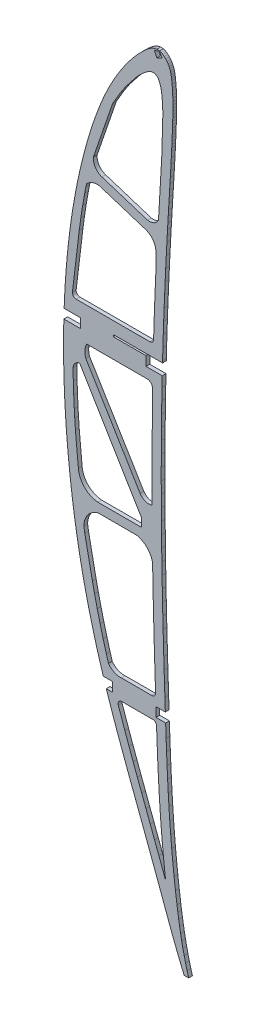
from build123d import *

# Parameters (mm, degrees)
EXTRUDE_1_DEPTH = 2


with BuildPart() as part:
    # Model → 凸台-拉伸1 (new body)
    with BuildSketch(Plane.XY):
        Polygon((90.473003067, 1.41610891), (89.253557397, 4.288175533), (87.979767081, 7.350528261), (86.732471254, 10.425048243), (85.532789181, 13.463610884), (84.359776075, 16.510344587), (83.207437646, 19.564987634), (82.069866843, 22.625280213), (80.942112045, 25.690005178), (78.696331215, 31.825885593), (76.43986619, 37.954292857), (74.167721729, 44.075008873), (71.882851357, 50.189163547), (69.589164029, 56.298929455), (67.29052508, 62.407478217), (64.987846318, 68.51685155), (62.687034794, 74.629309266), (60.403516624, 80.712493446), (58.137806844, 86.800458967), (55.899721459, 92.897638218), (53.702073618, 99.008594441), (51.556721043, 105.136848216), (48.778942839, 113.429300475), (52.16898735, 113.429300475), (52.16898735, 118.429300475), (47.16898735, 118.429300475), (45.586350646, 123.53893903), (43.790673343, 129.636416133), (42.081040848, 135.757669087), (40.460450305, 141.902828751), (38.927946285, 148.070852457), (37.487524982, 154.261914681), (36.138230966, 160.474972757), (34.901671713, 166.604869103), (33.753547937, 172.749637105), (32.690818877, 178.910144953), (31.711617292, 185.083308263), (30.812946039, 191.268996178), (29.991807972, 197.467077839), (29.246248616, 203.676466959), (28.577057316, 209.856158942), (27.981708345, 216.041076856), (27.459246275, 222.230178034), (27.010582916, 228.425504191), (26.636760934, 234.626099898), (26.339778426, 240.832052395), (26.118679964, 247.042319013), (25.975158308, 253.263980329), (25.909736891, 259.485047765), (25.926411906, 265.705695797), (26.024227924, 271.924881759), (26.068234366, 273.429300475), (34.851363013, 273.429300475), (34.851363013, 278.429300475), (33.851363013, 278.429300475), (26.218453414, 278.429300475), (26.474228879, 284.360346332), (26.82945458, 290.575756753), (27.279795366, 296.85938096), (27.825569166, 303.13516043), (28.469947602, 309.399229829), (29.218968583, 315.650851824), (30.075760111, 321.887160129), (31.046360095, 328.107417412), (32.134851967, 334.309800055), (32.736576301, 337.470054764), (33.370662752, 340.622713859), (34.03811037, 343.767820961), (34.736877437, 346.906287877), (35.470048338, 350.036247371), (36.236536785, 353.159653918), (37.038384494, 356.27559571), (37.89707812, 359.465087089), (38.794302631, 362.643248378), (39.73309879, 365.809211386), (40.715508313, 368.962064305), (41.744615584, 372.099939896), (42.822462319, 375.22192635), (43.952045662, 378.328154524), (44.559657154, 379.932184847), (45.181517037, 381.530831551), (45.819710646, 383.12218378), (46.475237031, 384.706285153), (47.148183429, 386.281137573), (47.838506221, 387.847740089), (48.549289791, 389.404225462), (49.315270137, 391.026180797), (50.103796595, 392.636108133), (50.916780024, 394.236092803), (51.753308614, 395.824093092), (52.614206936, 397.404148812), (53.502559373, 398.974392725), (54.418278687, 400.536822928), (55.437097076, 402.213859329), (56.48754025, 403.877262208), (57.565005544, 405.517822033), (58.667669338, 407.131455374), (59.7947943, 408.712124321), (60.942689573, 410.252661059), (62.110574206, 411.748026728), (62.837246184, 412.642575126), (63.57747284, 413.52470295), (64.33603132, 414.399623536), (65.119566005, 415.275634608), (65.934808517, 416.159035789), (66.787491429, 417.056083085), (67.68534541, 417.973119742), (68.936807891, 419.204880131), (70.257645091, 420.406638048), (71.630192071, 421.50154982), (73.03773932, 422.413814442), (74.461622851, 423.066544624), (75.886175821, 423.382983932), (77.292734243, 423.286245075), (78.143620727, 422.993296421), (78.15449601, 422.989552209), (78.990530005, 422.525577899), (79.786583637, 421.922727491), (80.53066413, 421.20349928), (81.210560612, 420.395386804), (81.813194019, 419.522842836), (82.326397097, 418.612361863), (82.699716633, 417.787861091), (83.002321842, 416.955268101), (83.244203207, 416.115019087), (83.436350258, 415.267593862), (83.588709857, 414.414427669), (83.712227916, 413.55699937), (83.815895868, 412.695701538), (83.976199307, 411.156228638), (84.108660253, 409.612537252), (84.216319471, 408.063759187), (84.299089722, 406.511892542), (84.359968151, 404.957068173), (84.399866568, 403.401327798), (84.420695829, 401.84675675), (84.423673081, 400.288403409), (84.410534703, 398.732349302), (84.383322411, 397.17768262), (84.345120589, 395.622536125), (84.298839142, 394.069038772), (84.245564358, 392.515236082), (84.187337951, 390.960216248), (84.128199736, 389.403154698), (84.066020756, 387.846961337), (84.00184368, 386.290680738), (83.935668508, 384.734312901), (83.866496191, 383.177814205), (83.794326729, 381.621184651), (83.72015917, 380.064467858), (83.56196443, 376.947600933), (83.392736539, 373.831253244), (83.216428073, 370.716598315), (83.032083601, 367.60259348), (82.844741984, 364.488457786), (82.654403223, 361.374191234), (82.464108081, 358.258925634), (82.274855607, 355.142704605), (82.08755761, 352.027569863), (81.90221409, 348.913521408), (81.720910382, 345.798648383), (81.54160477, 342.683862596), (81.366338971, 339.568252239), (81.194113936, 336.451773691), (80.863388825, 330.225421557), (80.550602962, 324.000853619), (80.254844538, 317.776028164), (79.977112602, 311.550988809), (79.717494392, 305.323737458), (79.477944385, 299.095360399), (79.258506201, 292.864858582), (79.059655454, 286.644264207), (78.881784721, 280.424585839), (78.856366691, 279.429300475), (52.520828256, 279.429300475), (52.520828256, 278.429300475), (70.05698217, 278.429300475), (70.05698217, 273.429300475), (78.705749157, 273.429300475), (78.585074338, 267.98580455), (78.467277356, 261.765746201), (78.369592196, 255.543563094), (78.29197524, 249.320254279), (78.234077532, 243.103812141), (78.196117169, 236.889241439), (78.177138722, 230.675499506), (78.175144095, 224.462499101), (78.191219574, 218.24828575), (78.223323445, 212.03377126), (78.271542945, 205.816957536), (78.334573691, 199.604794296), (78.412546541, 193.394284394), (78.504506066, 187.184385164), (78.611407695, 180.976139274), (78.732339619, 174.767505006), (78.866346408, 168.557439694), (79.014383492, 162.346986005), (79.175364583, 156.138098416), (79.348247014, 149.931732357), (79.531076308, 143.726801539), (79.723939703, 137.521307868), (79.922753769, 131.31707496), (80.129691078, 125.110193863), (80.357055187, 118.429300475), (75.357055187, 118.429300475), (75.357055187, 113.429300475), (80.528909173, 113.429300475), (80.78156074, 106.488904678), (81.024376546, 100.285591975), (81.29116951, 94.083326138), (81.58888935, 87.88341155), (81.923617593, 81.684111831), (82.304345673, 75.485819556), (82.73537512, 69.281715865), (83.221221361, 63.083008384), (83.765880588, 56.889871592), (84.373348996, 50.702479966), (85.045668299, 44.519921696), (85.787790119, 38.343413929), (86.603797889, 32.171133044), (87.043688275, 29.06536479), (87.509335819, 25.965725881), (88.006778428, 22.871478986), (88.542922201, 19.784927535), (89.122718761, 16.707288676), (89.753074205, 13.640865839), (90.439939204, 10.58691979), (91.202827502, 7.48824726), (92.022138116, 4.404049614), (92.864001663, 1.41610891), align=None)
        with BuildLine():
            Line((75.329172034, 320.753316065), (75.051440098, 314.52827671))
            Line((75.051440098, 314.52827671), (74.791821888, 308.301025359))
            Line((74.791821888, 308.301025359), (74.552271881, 302.0726483))
            Line((74.552271881, 302.0726483), (74.332833697, 295.842146483))
            Line((74.332833697, 295.842146483), (74.13398295, 289.621552108))
            Line((74.13398295, 289.621552108), (74.083303286, 287.849415632))
            ThreePointArc((74.083303286, 287.849415632), (73.477974017, 286.472303626), (72.084120633, 285.906588376))
            Line((72.084120633, 285.906588376), (32.626781308, 285.906588376))
            ThreePointArc((32.626781308, 285.906588376), (31.130812418, 286.579155863), (30.640983564, 288.144511299))
            Line((30.640983564, 288.144511299), (34.293296079, 318.628139725))
            Line((34.293296079, 318.628139725), (35.150087607, 324.86444803))
            Line((35.150087607, 324.86444803), (36.120687591, 331.084705314))
            Line((36.120687591, 331.084705314), (37.209179463, 337.287087956))
            Line((37.209179463, 337.287087956), (37.810903797, 340.447342665))
            Line((37.810903797, 340.447342665), (38.260180998, 342.188405306))
            ThreePointArc((38.260180998, 342.188405306), (41.322072446, 344.253225506), (44.990400044, 344.679880321))
            Line((44.990400044, 344.679880321), (69.935330866, 336.724877648))
            ThreePointArc((69.935330866, 336.724877648), (73.685146901, 333.998693125), (75.315891128, 329.658891792))
            Line((75.315891128, 329.658891792), (75.329172034, 320.753316065))
        make_face(mode=Mode.SUBTRACT)
        with BuildLine():
            Line((31.889300602, 230.437217329), (31.636760934, 234.626099898))
            Line((31.636760934, 234.626099898), (31.339778426, 240.832052395))
            Line((31.339778426, 240.832052395), (31.118679964, 247.042319013))
            Line((31.118679964, 247.042319013), (30.975158308, 253.263980329))
            ThreePointArc((30.975158308, 253.263980329), (32.064829087, 255.843178682), (34.506592179, 257.213375584))
            Line((34.506592179, 257.213375584), (67.600794136, 202.155839455))
            Line((67.600794136, 202.155839455), (67.600794136, 197.619168225))
            Line((67.600794136, 197.619168225), (44.26989943, 197.619168225))
            ThreePointArc((44.26989943, 197.619168225), (37.079099453, 200.952980917), (33.822596969, 208.179121169))
            Line((33.822596969, 208.179121169), (32.264348235, 224.892709601))
            Line((32.264348235, 224.892709601), (31.889300602, 230.437217329))
        make_face(mode=Mode.SUBTRACT)
        with BuildLine():
            Line((57.101110617, 111.634796951), (73.665715927, 111.634796951))
            ThreePointArc((73.665715927, 111.634796951), (75.053967379, 111.074504527), (75.66439206, 109.707554856))
            Line((75.66439206, 109.707554856), (75.78156074, 106.488904678))
            Line((75.78156074, 106.488904678), (76.024376546, 100.285591975))
            Line((76.024376546, 100.285591975), (76.29116951, 94.083326138))
            Line((76.29116951, 94.083326138), (76.58888935, 87.88341155))
            Line((76.58888935, 87.88341155), (76.923617593, 81.684111831))
            Line((76.923617593, 81.684111831), (77.304345673, 75.485819556))
            Line((77.304345673, 75.485819556), (77.73537512, 69.281715865))
            Line((77.73537512, 69.281715865), (78.221221361, 63.083008384))
            Line((78.221221361, 63.083008384), (78.765880588, 56.889871592))
            Line((78.765880588, 56.889871592), (79.373348996, 50.702479966))
            Line((79.373348996, 50.702479966), (80.045668299, 44.519921696))
            Line((80.045668299, 44.519921696), (80.544859859, 40.365266138))
            Line((80.544859859, 40.365266138), (79.167721729, 44.075008873))
            Line((79.167721729, 44.075008873), (76.882851357, 50.189163547))
            Line((76.882851357, 50.189163547), (74.589164029, 56.298929455))
            Line((74.589164029, 56.298929455), (72.29052508, 62.407478217))
            Line((72.29052508, 62.407478217), (69.987846318, 68.51685155))
            Line((69.987846318, 68.51685155), (67.687034794, 74.629309266))
            Line((67.687034794, 74.629309266), (65.403516624, 80.712493446))
            Line((65.403516624, 80.712493446), (63.137806844, 86.800458967))
            Line((63.137806844, 86.800458967), (60.899721459, 92.897638218))
            Line((60.899721459, 92.897638218), (58.702073618, 99.008594441))
            Line((58.702073618, 99.008594441), (55.21343845, 108.973968843))
            ThreePointArc((55.21343845, 108.973968843), (55.469906121, 110.792022898), (57.101110617, 111.634796951))
        make_face(mode=Mode.SUBTRACT)
        with BuildLine():
            Line((49.93362317, 125.755367801), (48.790673343, 129.636416133))
            Line((48.790673343, 129.636416133), (47.081040848, 135.757669087))
            Line((47.081040848, 135.757669087), (45.460450305, 141.902828751))
            Line((45.460450305, 141.902828751), (43.927946285, 148.070852457))
            Line((43.927946285, 148.070852457), (42.487524982, 154.261914681))
            Line((42.487524982, 154.261914681), (41.322337121, 159.627696875))
            Line((41.322337121, 159.627696875), (37.245897821, 179.770124731))
            Line((37.245897821, 179.770124731), (36.773361353, 182.761738123))
            ThreePointArc((36.773361353, 182.761738123), (38.8987198, 189.012678277), (44.365194146, 192.715252996))
            Line((44.365194146, 192.715252996), (64.965492486, 192.715252996))
            ThreePointArc((64.965492486, 192.715252996), (70.510632219, 189.80353417), (73.540445183, 184.322027572))
            Line((73.540445183, 184.322027572), (73.611407695, 180.976139274))
            Line((73.611407695, 180.976139274), (73.732339619, 174.767505006))
            Line((73.732339619, 174.767505006), (73.866346408, 168.557439694))
            Line((73.866346408, 168.557439694), (74.014383492, 162.346986005))
            Line((74.014383492, 162.346986005), (74.175364583, 156.138098416))
            Line((74.175364583, 156.138098416), (74.547277265, 142.786676685))
            Line((74.547277265, 142.786676685), (75.139811187, 124.543536209))
            ThreePointArc((75.139811187, 124.543536209), (74.577519887, 123.088097565), (73.140837273, 122.479479276))
            Line((73.140837273, 122.479479276), (56.845348153, 122.479479276))
            ThreePointArc((56.845348153, 122.479479276), (52.952868439, 123.196214487), (49.93362317, 125.755367801))
        make_face(mode=Mode.SUBTRACT)
        with BuildLine():
            Line((46.443219819, 349.419578784), (70.773281648, 341.660659417))
            ThreePointArc((70.773281648, 341.660659417), (74.207721705, 342.072547867), (76.698064621, 344.473219183))
            Line((76.698064621, 344.473219183), (78.458064621, 374.988219183))
            Line((78.458064621, 374.988219183), (79.018064621, 394.358219183))
            Line((79.018064621, 394.358219183), (78.998064621, 396.289219183))
            Line((78.998064621, 396.289219183), (78.968064621, 397.225219183))
            Line((78.968064621, 397.225219183), (78.918064621, 398.592219183))
            Line((78.918064621, 398.592219183), (78.608064621, 402.777219183))
            Line((78.608064621, 402.777219183), (78.238064621, 405.316219183))
            Line((78.238064621, 405.316219183), (77.818064621, 407.201219183))
            Line((77.818064621, 407.201219183), (77.378064621, 408.546219183))
            Line((77.378064621, 408.546219183), (76.692214443, 409.978811335))
            Line((76.692214443, 409.978811335), (76.270238534, 410.564262661))
            Line((76.270238534, 410.564262661), (74.82099145, 411.526085036))
            Line((74.82099145, 411.526085036), (73.208064621, 411.529219183))
            Line((73.208064621, 411.529219183), (71.878064621, 411.014219183))
            Line((71.878064621, 411.014219183), (70.908064621, 410.451219183))
            Line((70.908064621, 410.451219183), (69.297664621, 409.264754567))
            Line((69.297664621, 409.264754567), (67.488064621, 407.630219183))
            Line((67.488064621, 407.630219183), (66.378064621, 406.521219183))
            Line((66.378064621, 406.521219183), (64.757945809, 404.778302351))
            Line((64.757945809, 404.778302351), (59.438064621, 398.056219183))
            Line((59.438064621, 398.056219183), (56.228064621, 393.242219183))
            Line((56.228064621, 393.242219183), (52.148064621, 386.281219183))
            Line((52.148064621, 386.281219183), (41.888064621, 356.432219183))
            ThreePointArc((41.888064621, 356.432219183), (42.914102718, 352.112944612), (46.443219819, 349.419578784))
        make_face(mode=Mode.SUBTRACT)
        Polygon((77.278744656, 423.265887629), (74.55380851, 422.012834955), (75.805862136, 419.28785519), (78.531840949, 420.539952435), align=None, mode=Mode.SUBTRACT)
        with BuildLine():
            Line((73.418434776, 258.654654648), (73.213668955, 210.769031566))
            ThreePointArc((73.213668955, 210.769031566), (69.643660068, 210.729883679), (66.873757403, 212.982467803))
            Line((66.873757403, 212.982467803), (37.844640132, 260.946496812))
            ThreePointArc((37.844640132, 260.946496812), (37.356422611, 264.480687175), (38.270711498, 267.929300475))
            Line((38.270711498, 267.929300475), (70.526651581, 267.929300475))
            ThreePointArc((70.526651581, 267.929300475), (72.667961184, 267.030441399), (73.52611374, 264.872495929))
            Line((73.52611374, 264.872495929), (73.418434776, 258.654654648))
        make_face(mode=Mode.SUBTRACT)
    extrude(amount=EXTRUDE_1_DEPTH)


solid = part.part
